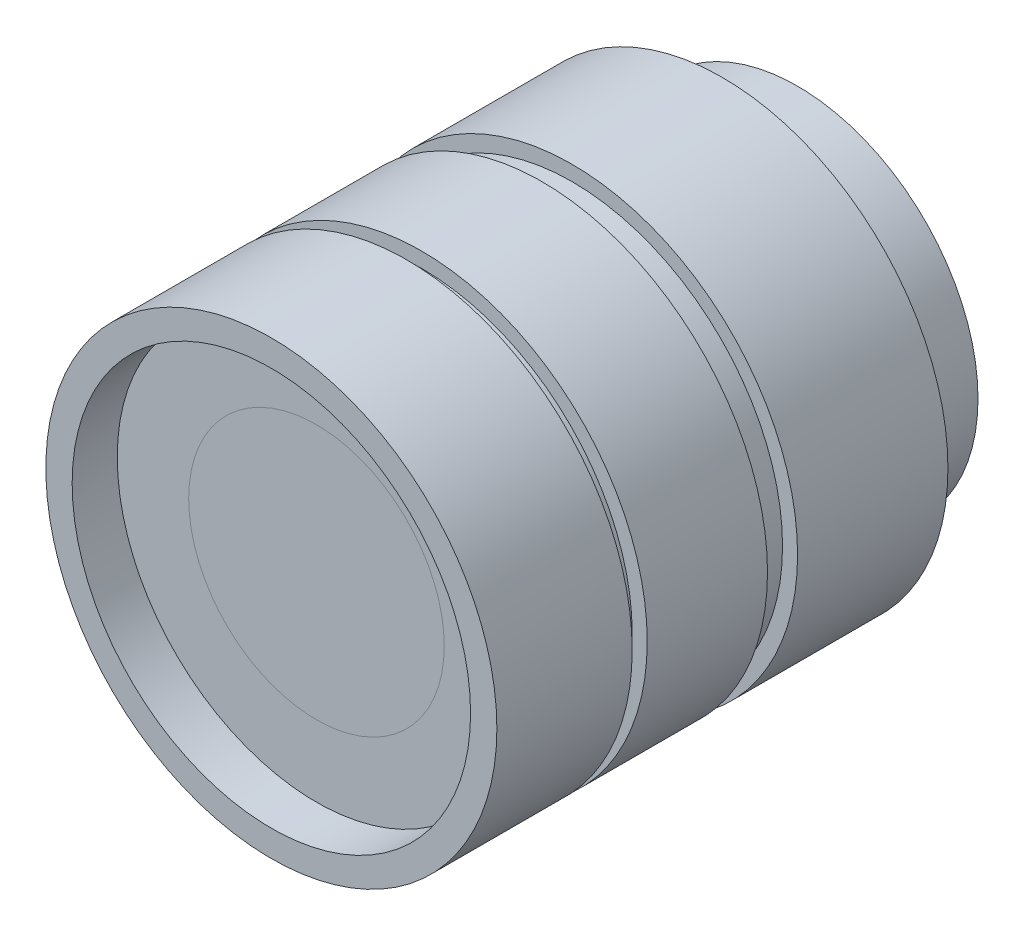
from build123d import *

# Parameters (mm, degrees)
SKETCH1_R           = 15
BASE_DEPTH          = 10
SKETCH2_R           = 14
BOSS_EXTRUDE2_DEPTH = 2
SKETCH3_R           = 15
BOSS_EXTRUDE3_DEPTH = 8
SKETCH4_R           = 14
BOSS_EXTRUDE4_DEPTH = 1
SKETCH5_R           = 15
BOSS_EXTRUDE5_DEPTH = 9
SKETCH6_R           = 13.25
CUT_EXTRUDE1_DEPTH  = 3
SKETCH8_R           = 12
BOSS_EXTRUDE6_DEPTH = 5


with BuildPart() as part:
    # Sketch1 → Base (new body)
    with BuildSketch(Plane.XY):
        Circle(SKETCH1_R)
    extrude(amount=BASE_DEPTH)

    # Sketch2 → Boss-Extrude2 (add)
    with BuildSketch(Plane.XY.offset(10)):
        Circle(SKETCH2_R)
    extrude(amount=BOSS_EXTRUDE2_DEPTH)

    # Sketch3 → Boss-Extrude3 (add)
    with BuildSketch(Plane.XY.offset(12)):
        Circle(SKETCH3_R)
    extrude(amount=BOSS_EXTRUDE3_DEPTH)

    # Sketch4 → Boss-Extrude4 (add)
    with BuildSketch(Plane.XY.offset(20)):
        Circle(SKETCH4_R)
    extrude(amount=BOSS_EXTRUDE4_DEPTH)

    # Sketch5 → Boss-Extrude5 (add)
    with BuildSketch(Plane.XY.offset(21)):
        Circle(SKETCH5_R)
    extrude(amount=BOSS_EXTRUDE5_DEPTH)

    # Sketch6 → Cut-Extrude1 (cut)
    with BuildSketch(Plane.XY.offset(30)):
        Circle(SKETCH6_R)
    extrude(amount=-CUT_EXTRUDE1_DEPTH, mode=Mode.SUBTRACT)


with BuildPart() as body_2:
    # Sketch8 → Boss-Extrude6 (new body)
    with BuildSketch(Plane(origin=(0, 0, 0), x_dir=(-1, 0, 0), z_dir=(0, 0, -1))):
        Circle(SKETCH8_R)
    extrude(amount=BOSS_EXTRUDE6_DEPTH)


solid = Compound([part.part, body_2.part])
